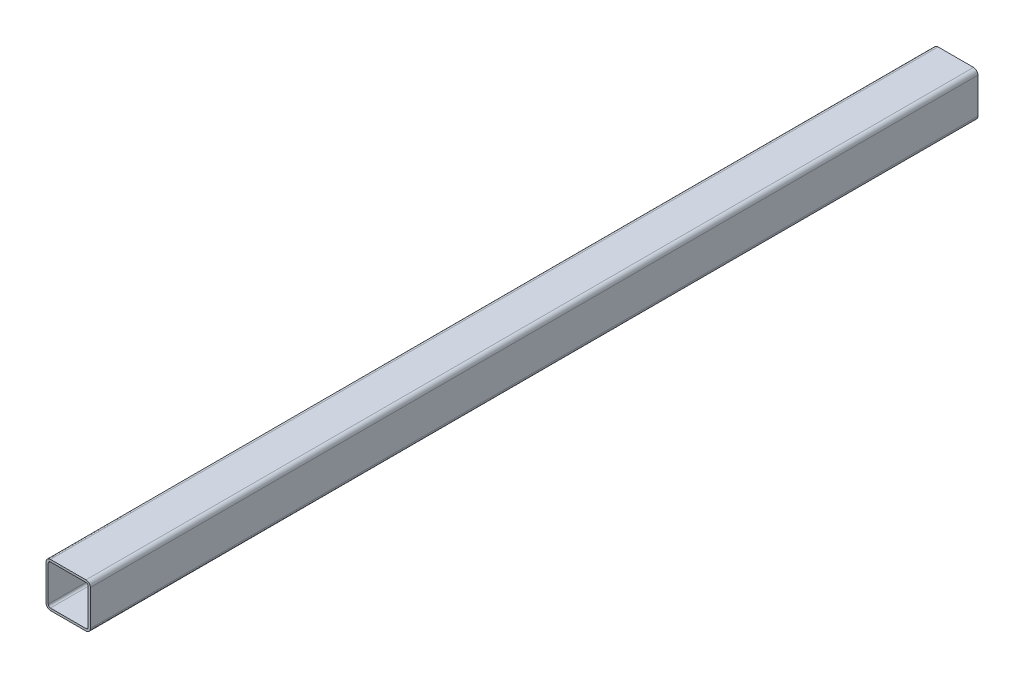
from build123d import *

# Parameters (mm, degrees)
SHS100X100X5_1_DEPTH = 2000


with BuildPart() as part:
    # Sketch11 → SHS100x100x5 (1) (new body)
    with BuildSketch(Plane.XY):
        with BuildLine():
            Line((-40, -50), (40, -50))
            ThreePointArc((40, -50), (47.071067812, -47.071067812), (50, -40))
            Line((50, -40), (50, 40))
            ThreePointArc((50, 40), (47.071067812, 47.071067812), (40, 50))
            Line((40, 50), (-40, 50))
            ThreePointArc((-40, 50), (-47.071067812, 47.071067812), (-50, 40))
            Line((-50, 40), (-50, -40))
            ThreePointArc((-50, -40), (-47.071067812, -47.071067812), (-40, -50))
        make_face()
        with BuildLine():
            Line((-40, -45), (40, -45))
            ThreePointArc((40, -45), (43.535533906, -43.535533906), (45, -40))
            Line((45, -40), (45, 40))
            ThreePointArc((45, 40), (43.535533906, 43.535533906), (40, 45))
            Line((40, 45), (-40, 45))
            ThreePointArc((-40, 45), (-43.535533906, 43.535533906), (-45, 40))
            Line((-45, 40), (-45, -40))
            ThreePointArc((-45, -40), (-43.535533906, -43.535533906), (-40, -45))
        make_face(mode=Mode.SUBTRACT)
    extrude(amount=SHS100X100X5_1_DEPTH)


solid = part.part
